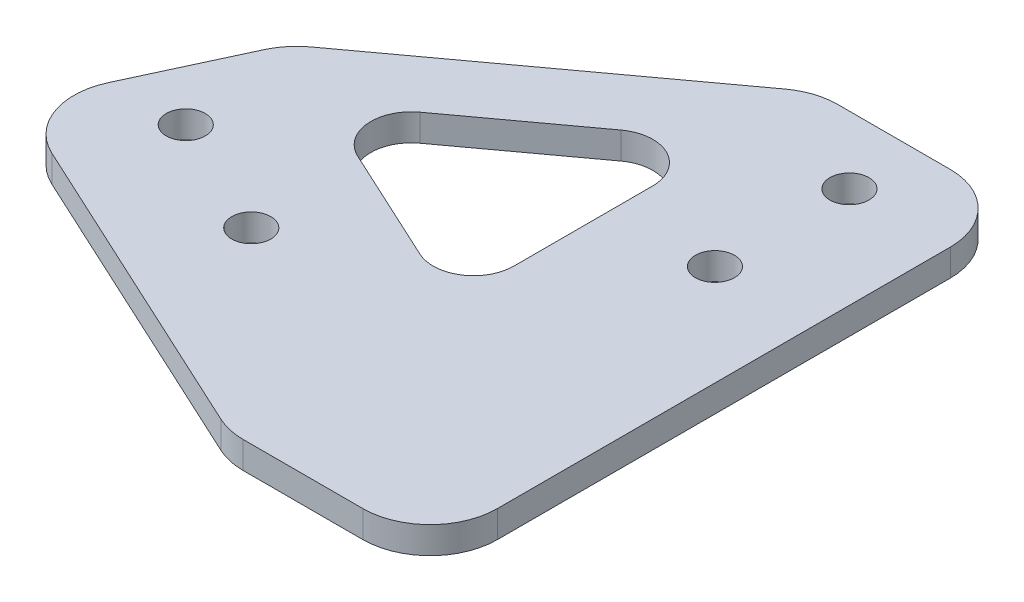
from build123d import *

# Parameters (mm, degrees)
SKETCH_1_R      = 1.45
EXTRUDE_1_DEPTH = 2
FILLET_1_R      = 5
FILLET_2_R      = 3


with BuildPart() as part:
    # 草图1 → 凸台-拉伸1 (new body)
    with BuildSketch(Plane(origin=(0, 0, 0), x_dir=(1, 0, 0), z_dir=(0, 1, 0))):
        Polygon((207.315214967, -87.759054481), (201.010915634, -101.369925501), (230, -114.797123874), (245, -114.797123874), (245, -111.623574981), (245, -71.122908945), (230, -71.122908945), align=None)
        with Locations(Location((217.77393632, -100.868789323, 0), (0, 0, 270))):
            Circle(SKETCH_1_R, mode=Mode.SUBTRACT)
        with Locations(Location((208.700022307, -96.665923102, 0), (0, 0, 270))):
            Circle(SKETCH_1_R, mode=Mode.SUBTRACT)
        with Locations(Location((237.5, -86.122908945, 0), (0, 0, 270))):
            Circle(SKETCH_1_R, mode=Mode.SUBTRACT)
        with Locations(Location((237.5, -76.122908945, 0), (0, 0, 270))):
            Circle(SKETCH_1_R, mode=Mode.SUBTRACT)
        Polygon((230, -77.323350324), (230, -98.266220035), (212.497179662, -90.159243016), align=None, mode=Mode.SUBTRACT)
    extrude(amount=EXTRUDE_1_DEPTH)

    # 圆角1
    fillet_1_edges = [part.edges().sort_by_distance(p)[0] for p in [
        (230, 1, 71.122908945),
        (245, 1, 71.122908945),
        (245, 1, 114.797123874),
        (230, 1, 114.797123874),
        (201.010915634, 1, 101.369925501),
        (207.315214967, 1, 87.759054481),
    ]]
    fillet(fillet_1_edges, radius=FILLET_1_R)

    # 圆角2
    fillet_2_edges = [part.edges().sort_by_distance(p)[0] for p in [
        (230, 1, 77.323350324),
        (212.497179662, 1, 90.159243016),
        (230, 1, 98.266220035),
    ]]
    fillet(fillet_2_edges, radius=FILLET_2_R)


solid = part.part
